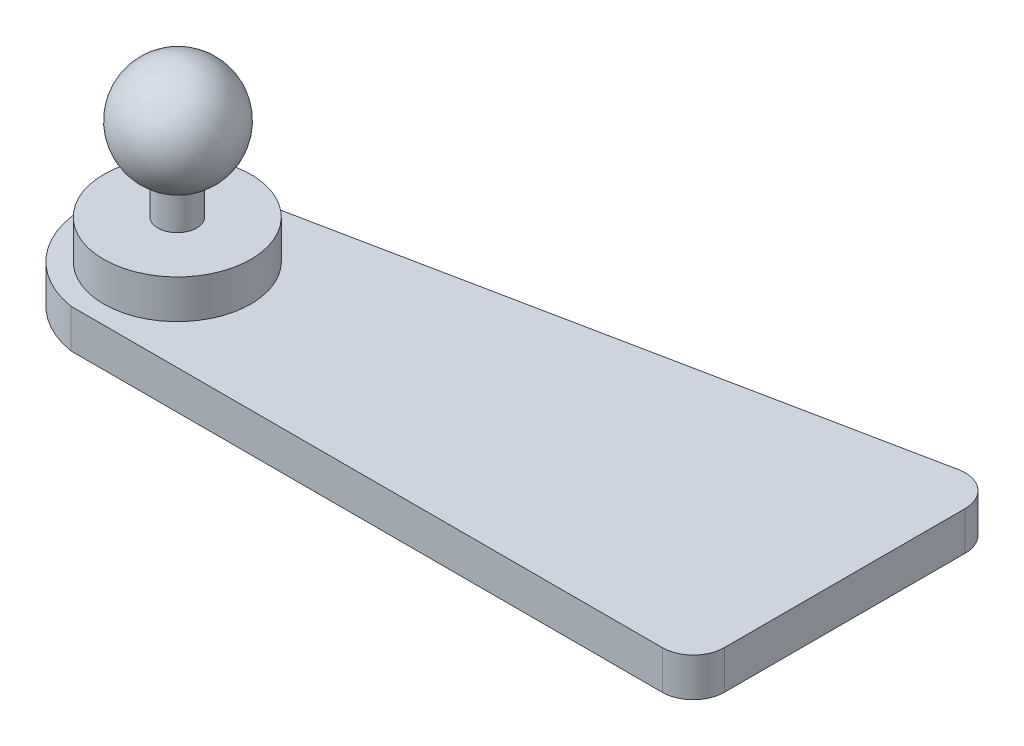
from build123d import *

# Parameters (mm, degrees)
BOSS_EXTRUDE1_DEPTH = 3.175
SKETCH2_R           = 6.0325
BOSS_EXTRUDE2_DEPTH = 3.175
SKETCH3_R           = 1.5875
BOSS_EXTRUDE3_DEPTH = 3.175
FILLET1_R           = 2.54


with BuildPart() as part:
    # Sketch1 → Boss-Extrude1 (new body)
    with BuildSketch(Plane(origin=(0, 0, 0), x_dir=(1, 0, 0), z_dir=(0, 1, 0))):
        with BuildLine():
            Line((0, 0), (51.026830118, 0))
            Line((51.026830118, 0), (51.026830118, 25.4))
            Line((51.026830118, 25.4), (-0.321385748, 14.994382636))
            ThreePointArc((-0.321385748, 14.994382636), (-6.426220151, 7.362897615), (0, 0))
        make_face()
    extrude(amount=BOSS_EXTRUDE1_DEPTH)

    # Sketch2 → Boss-Extrude2 (add)
    with BuildSketch(Plane(origin=(0, 3.175, 0), x_dir=(1, 0, 0), z_dir=(0, 1, 0))):
        with Locations(Location((1.192030118, 7.526185235, 0), (0, 0, 270))):
            Circle(SKETCH2_R)
    extrude(amount=BOSS_EXTRUDE2_DEPTH)

    # Sketch3 → Boss-Extrude3 (add)
    with BuildSketch(Plane(origin=(0, 6.35, 0), x_dir=(1, 0, 0), z_dir=(0, 1, 0))):
        with Locations(Location((1.192030118, 7.526185235, 0), (0, 0, 270))):
            Circle(SKETCH3_R)
    extrude(amount=BOSS_EXTRUDE3_DEPTH)

    # Sketch5 → Revolve1 (revolve)
    with BuildSketch(Plane.XY.offset(-7.526185235)):
        with BuildLine():
            Line((1.250961313, 17.526), (1.250961313, 8.89))
            ThreePointArc((1.250961313, 8.89), (-3.067038687, 13.208), (1.250961313, 17.526))
        make_face()
    revolve(axis=Axis((1.250961313, 17.526, -7.526185235), (0, -1, 0)))

    # Fillet1
    fillet1_edges = [part.edges().sort_by_distance(p)[0] for p in [
        (51.026830118, 1.5875, 0),
        (51.026830118, 1.5875, -25.4),
    ]]
    fillet(fillet1_edges, radius=FILLET1_R)


solid = part.part
